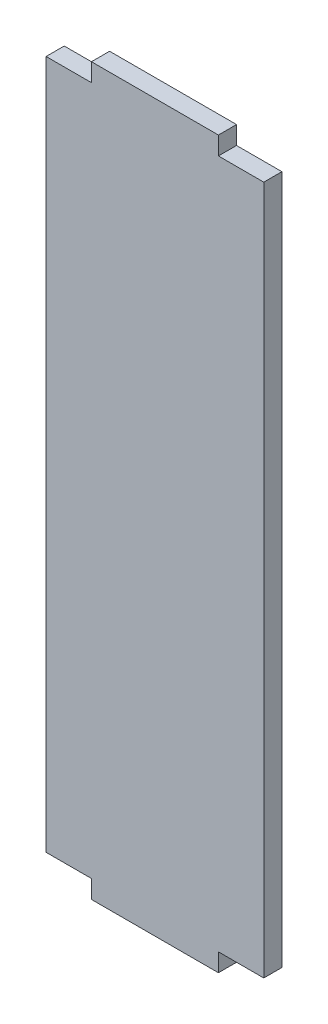
from build123d import *

# Parameters (mm, degrees)
ESQUISSE1_W        = 60
ESQUISSE1_H        = 190
BOSS_EXTRU_1_DEPTH = 5
ESQUISSE2_W        = 35
ESQUISSE2_H        = 5
BOSS_EXTRU_2_DEPTH = 5


with BuildPart() as part:
    # Esquisse1 → Boss.-Extru.1 (new body)
    with BuildSketch(Plane.XY):
        Rectangle(ESQUISSE1_W, ESQUISSE1_H)
    extrude(amount=BOSS_EXTRU_1_DEPTH)

    # Esquisse2 → Boss.-Extru.2 (add)
    with BuildSketch(Plane.XY.offset(5)):
        with Locations((0, -97.5)):
            Rectangle(ESQUISSE2_W, ESQUISSE2_H)
        with Locations((0, 97.5)):
            Rectangle(ESQUISSE2_W, ESQUISSE2_H)
    extrude(amount=-BOSS_EXTRU_2_DEPTH)


solid = part.part
